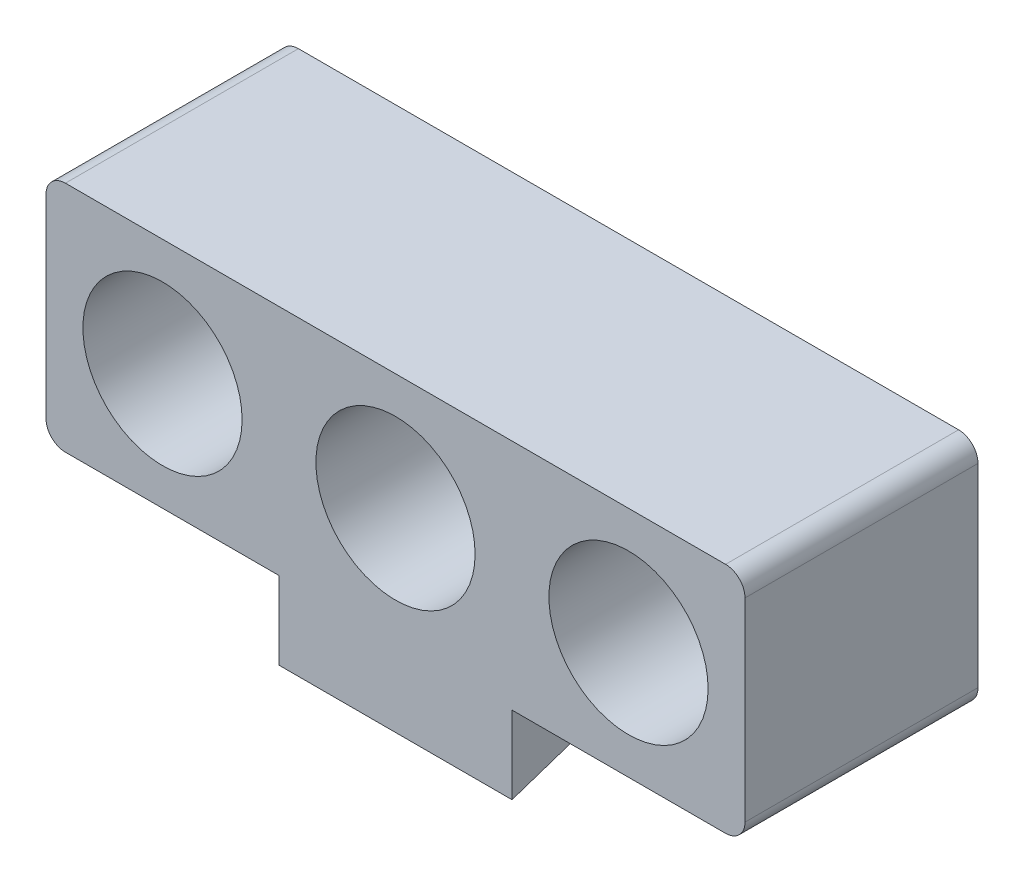
from build123d import *

# Parameters (mm, degrees)
SKETCH1_W             = 36
SKETCH1_H             = 12
BOSS_EXTRUDE1_DEPTH   = 12
F_3_0MM_DOWEL_HOLE1_D = 8.2
BOSS_EXTRUDE2_DEPTH   = 6
FILLET2_R             = 1


with BuildPart() as part:
    # Sketch1 → Boss-Extrude1 (new body)
    with BuildSketch(Plane.XY):
        Rectangle(SKETCH1_W, SKETCH1_H)
    extrude(amount=BOSS_EXTRUDE1_DEPTH)

    # Ø3.0mm Dowel Hole1 (through all)
    with Locations(Plane.XY.offset(12)):
        with Locations((-12, 0), (12, 0), (0, 0)):
            Hole(F_3_0MM_DOWEL_HOLE1_D / 2)

    # Sketch4 → Boss-Extrude2 (add, symmetric)
    with BuildSketch(Plane.ZY):
        Polygon((12, -6), (12, -10), (0, -6), align=None)
    extrude(amount=BOSS_EXTRUDE2_DEPTH, both=True)

    # Fillet2
    fillet2_edges = [part.edges().sort_by_distance(p)[0] for p in [
        (-18, 6, 6),
        (18, 6, 6),
        (18, -6, 6),
        (-18, -6, 6),
    ]]
    fillet(fillet2_edges, radius=FILLET2_R)


solid = part.part
